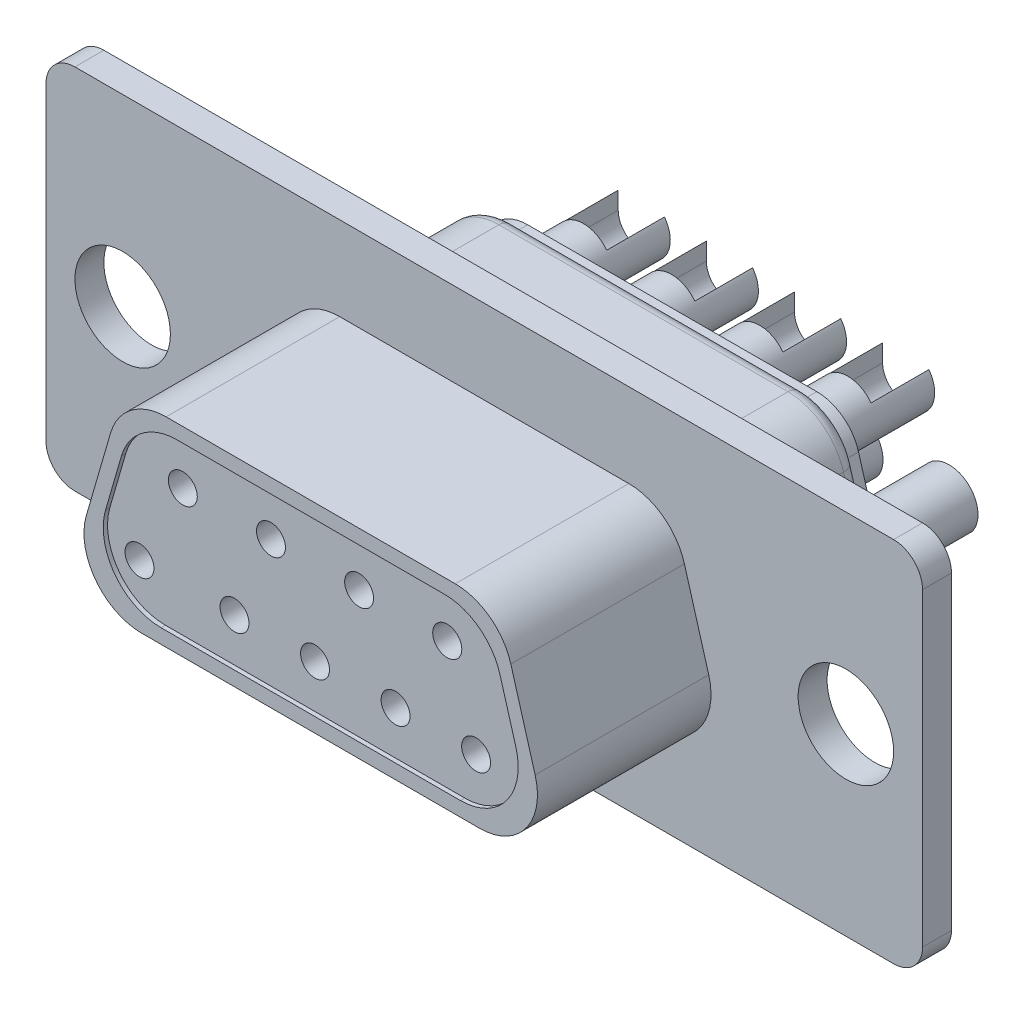
from build123d import *

# Parameters (mm, degrees)
SKETCH1_W       = 30.3
SKETCH1_H       = 12.7
EXTRUDE1_DEPTH  = 1
SKETCH2_R       = 1.65
EXTRUDE2_DEPTH  = 17.45736917
EXTRUDE3_DEPTH  = 6
FILLET2_R       = 1
EXTRUDE4_DEPTH  = 5
FILLET1_R       = 2
FILLET3_R       = 0.5
EXTRUDE5_DEPTH  = 0.5
SKETCH6_R       = 1
EXTRUDE6_DEPTH  = 3.5
EXTRUDE15_DEPTH = 2
EXTRUDE16_START = 5.85
SKETCH8_R       = 0.5
SKETCH8_R_2     = 0.502640461
EXTRUDE16_DEPTH = 5.85


with BuildPart() as part:
    # Sketch1 → Extrude1 (new body)
    with BuildSketch(Plane.XY):
        Rectangle(SKETCH1_W, SKETCH1_H)
    extrude(amount=EXTRUDE1_DEPTH)

    # Sketch2 → Extrude2 (cut, through all)
    with BuildSketch(Plane.XY.offset(1)):
        with Locations((-12.5, 0)):
            Circle(SKETCH2_R)
        with Locations((12.5, 0)):
            Circle(SKETCH2_R)
    extrude(amount=-EXTRUDE2_DEPTH, mode=Mode.SUBTRACT)

    # Sketch3 → Extrude3 (add)
    with BuildSketch(Plane.XY.offset(1)):
        Polygon((6.5, 3.45), (-6.5, 3.45), (-8.5, -3.45), (8.5, -3.45), align=None)
        Polygon((-7.834492027, -2.95), (-6.1243471, 2.95), (6.1243471, 2.95), (7.834492027, -2.95), align=None, mode=Mode.SUBTRACT)
    extrude(amount=EXTRUDE3_DEPTH)

    # Fillet2
    fillet2_edges = [part.edges().sort_by_distance(p)[0] for p in [
        (15.15, -6.35, 0.5),
        (-15.15, -6.35, 0.5),
        (-15.15, 6.35, 0.5),
        (15.15, 6.35, 0.5),
    ]]
    fillet(fillet2_edges, radius=FILLET2_R)

    # Sketch4 → Extrude4 (add)
    with BuildSketch(Plane(origin=(0, 0, 0), x_dir=(-1, 0, 0), z_dir=(0, 0, -1))):
        Polygon((-6.5, 3.45), (-8.5, -3.45), (8.5, -3.45), (6.5, 3.45), align=None)
    extrude(amount=EXTRUDE4_DEPTH)

    # Fillet1
    fillet1_edges = [part.edges().sort_by_distance(p)[0] for p in [
        (-6.1243471, 2.95, 4),
        (-6.5, 3.45, 4),
        (-7.834492027, -2.95, 4),
        (-8.5, -3.45, 4),
        (7.834492027, -2.95, 4),
        (8.5, -3.45, 4),
        (6.1243471, 2.95, 4),
        (6.5, 3.45, 4),
        (-8.5, -3.45, -2.5),
        (-6.5, 3.45, -2.5),
        (8.5, -3.45, -2.5),
        (6.5, 3.45, -2.5),
    ]]
    fillet(fillet1_edges, radius=FILLET1_R)

    # Fillet3
    fillet3_edges = [part.edges().sort_by_distance(p)[0] for p in [
        (7.436965325, -2.651335883, -5),
        (7.338610987, 0.556792096, -5),
        (6.198724282, 3.048997216, -5),
        (0, 3.45, -5),
        (-6.198724282, 3.048997216, -5),
        (-7.338610987, 0.556792096, -5),
        (-7.436965325, -2.651335883, -5),
        (0, -3.45, -5),
    ]]
    fillet(fillet3_edges, radius=FILLET3_R)

    # Sketch5 → Extrude5 (add)
    with BuildSketch(Plane(origin=(0, 0, -5), x_dir=(-1, 0, 0), z_dir=(0, 0, -1))):
        with BuildLine():
            Line((-4.997388399, 2.95), (4.997388399, 2.95))
            ThreePointArc((4.997388399, 2.95), (5.898390312, 2.649247912), (6.438087948, 1.867594072))
            Line((6.438087948, 1.867594072), (7.278667659, -1.032405928))
            ThreePointArc((7.278667659, -1.032405928), (7.037216021, -2.351001912), (5.837968109, -2.95))
            Line((5.837968109, -2.95), (-5.837968109, -2.95))
            ThreePointArc((-5.837968109, -2.95), (-7.037216021, -2.351001912), (-7.278667659, -1.032405928))
            Line((-7.278667659, -1.032405928), (-6.438087948, 1.867594072))
            ThreePointArc((-6.438087948, 1.867594072), (-5.898390312, 2.649247912), (-4.997388399, 2.95))
        make_face()
    extrude(amount=EXTRUDE5_DEPTH)

    # Sketch6 → Extrude6 (add)
    with BuildSketch(Plane(origin=(0, 0, -5.5), x_dir=(-1, 0, 0), z_dir=(0, 0, -1))):
        with Locations((-4.570282288, 1.45)):
            Circle(SKETCH6_R)
        with Locations((-1.523427429, 1.45)):
            Circle(SKETCH6_R)
        with Locations((1.523427429, 1.45)):
            Circle(SKETCH6_R)
        with Locations((4.570282288, 1.45)):
            Circle(SKETCH6_R)
        with Locations((6.067542907, -1.45)):
            Circle(SKETCH6_R)
        with Locations((2.783771454, -1.45)):
            Circle(SKETCH6_R)
        with Locations((0, -1.45)):
            Circle(SKETCH6_R)
        with Locations((-2.783771454, -1.45)):
            Circle(SKETCH6_R)
        with Locations((-6.067542907, -1.45)):
            Circle(SKETCH6_R)
    extrude(amount=EXTRUDE6_DEPTH)

    # Sketch7 → Extrude15 (cut)
    with BuildSketch(Plane(origin=(0, 0, -9), x_dir=(-1, 0, 0), z_dir=(0, 0, -1))):
        with BuildLine():
            Line((-2.323427429, 1.45), (-2.323427429, 2.45))
            Line((-2.323427429, 2.45), (-0.723427429, 2.45))
            Line((-0.723427429, 2.45), (-0.723427429, 1.45))
            ThreePointArc((-0.723427429, 1.45), (-1.523427429, 0.65), (-2.323427429, 1.45))
        make_face()
        with BuildLine():
            Line((-5.370282288, 1.45), (-5.370282288, 2.45))
            Line((-5.370282288, 2.45), (-3.770282288, 2.45))
            Line((-3.770282288, 2.45), (-3.770282288, 1.45))
            ThreePointArc((-3.770282288, 1.45), (-4.570282288, 0.65), (-5.370282288, 1.45))
        make_face()
        with BuildLine():
            Line((-6.867542907, -1.45), (-6.867542907, -2.45))
            Line((-6.867542907, -2.45), (-5.267542907, -2.45))
            Line((-5.267542907, -2.45), (-5.267542907, -1.45))
            ThreePointArc((-5.267542907, -1.45), (-6.067542907, -0.65), (-6.867542907, -1.45))
        make_face()
        with BuildLine():
            Line((0.723427429, 1.45), (0.723427429, 2.45))
            Line((0.723427429, 2.45), (2.323427429, 2.45))
            Line((2.323427429, 2.45), (2.323427429, 1.45))
            ThreePointArc((2.323427429, 1.45), (1.523427429, 0.65), (0.723427429, 1.45))
        make_face()
        with BuildLine():
            Line((3.770282288, 1.45), (3.770282288, 2.45))
            Line((3.770282288, 2.45), (5.370282288, 2.45))
            Line((5.370282288, 2.45), (5.370282288, 1.45))
            ThreePointArc((5.370282288, 1.45), (4.570282288, 0.65), (3.770282288, 1.45))
        make_face()
        with BuildLine():
            Line((-1.983771454, -1.45), (-1.983771454, -2.45))
            Line((-1.983771454, -2.45), (-3.583771454, -2.45))
            Line((-3.583771454, -2.45), (-3.583771454, -1.45))
            ThreePointArc((-3.583771454, -1.45), (-2.783771454, -0.65), (-1.983771454, -1.45))
        make_face()
        with BuildLine():
            Line((0.8, -1.45), (0.8, -2.45))
            Line((0.8, -2.45), (-0.8, -2.45))
            Line((-0.8, -2.45), (-0.8, -1.45))
            ThreePointArc((-0.8, -1.45), (0, -0.65), (0.8, -1.45))
        make_face()
        with BuildLine():
            Line((3.583771454, -1.45), (3.583771454, -2.45))
            Line((3.583771454, -2.45), (1.983771454, -2.45))
            Line((1.983771454, -2.45), (1.983771454, -1.45))
            ThreePointArc((1.983771454, -1.45), (2.783771454, -0.65), (3.583771454, -1.45))
        make_face()
        with BuildLine():
            Line((6.867542907, -1.45), (6.867542907, -2.45))
            Line((6.867542907, -2.45), (5.267542907, -2.45))
            Line((5.267542907, -2.45), (5.267542907, -1.45))
            ThreePointArc((5.267542907, -1.45), (6.067542907, -0.65), (6.867542907, -1.45))
        make_face()
    extrude(amount=-EXTRUDE15_DEPTH, mode=Mode.SUBTRACT)

    # Sketch8 → Extrude16 (add)
    with BuildSketch(Plane.XY.offset(1).offset(EXTRUDE16_START)):
        with BuildLine():
            Line((-4.621735499, 2.95), (4.621735499, 2.95))
            ThreePointArc((4.621735499, 2.95), (5.823071382, 2.548997216), (6.542668231, 1.506792096))
            Line((6.542668231, 1.506792096), (7.093392869, -0.393207904))
            ThreePointArc((7.093392869, -0.393207904), (6.771457353, -2.151335883), (5.172460137, -2.95))
            Line((5.172460137, -2.95), (-5.172460137, -2.95))
            ThreePointArc((-5.172460137, -2.95), (-6.771457353, -2.151335883), (-7.093392869, -0.393207904))
            Line((-7.093392869, -0.393207904), (-6.542668231, 1.506792096))
            ThreePointArc((-6.542668231, 1.506792096), (-5.823071382, 2.548997216), (-4.621735499, 2.95))
        make_face()
        with Locations((-4.570282288, 1.45)):
            Circle(SKETCH8_R, mode=Mode.SUBTRACT)
        with Locations((-1.523427429, 1.45)):
            Circle(SKETCH8_R, mode=Mode.SUBTRACT)
        with Locations((1.523427429, 1.45)):
            Circle(SKETCH8_R, mode=Mode.SUBTRACT)
        with Locations((4.570282288, 1.45)):
            Circle(SKETCH8_R_2, mode=Mode.SUBTRACT)
        with Locations((5.567542907, -1.45)):
            Circle(SKETCH8_R, mode=Mode.SUBTRACT)
        with Locations((2.783771454, -1.45)):
            Circle(SKETCH8_R, mode=Mode.SUBTRACT)
        with Locations((0, -1.45)):
            Circle(SKETCH8_R, mode=Mode.SUBTRACT)
        with Locations((-2.783771454, -1.45)):
            Circle(SKETCH8_R, mode=Mode.SUBTRACT)
        with Locations((-6.067542907, -1.45)):
            Circle(SKETCH8_R, mode=Mode.SUBTRACT)
    extrude(amount=-EXTRUDE16_DEPTH)


solid = part.part
